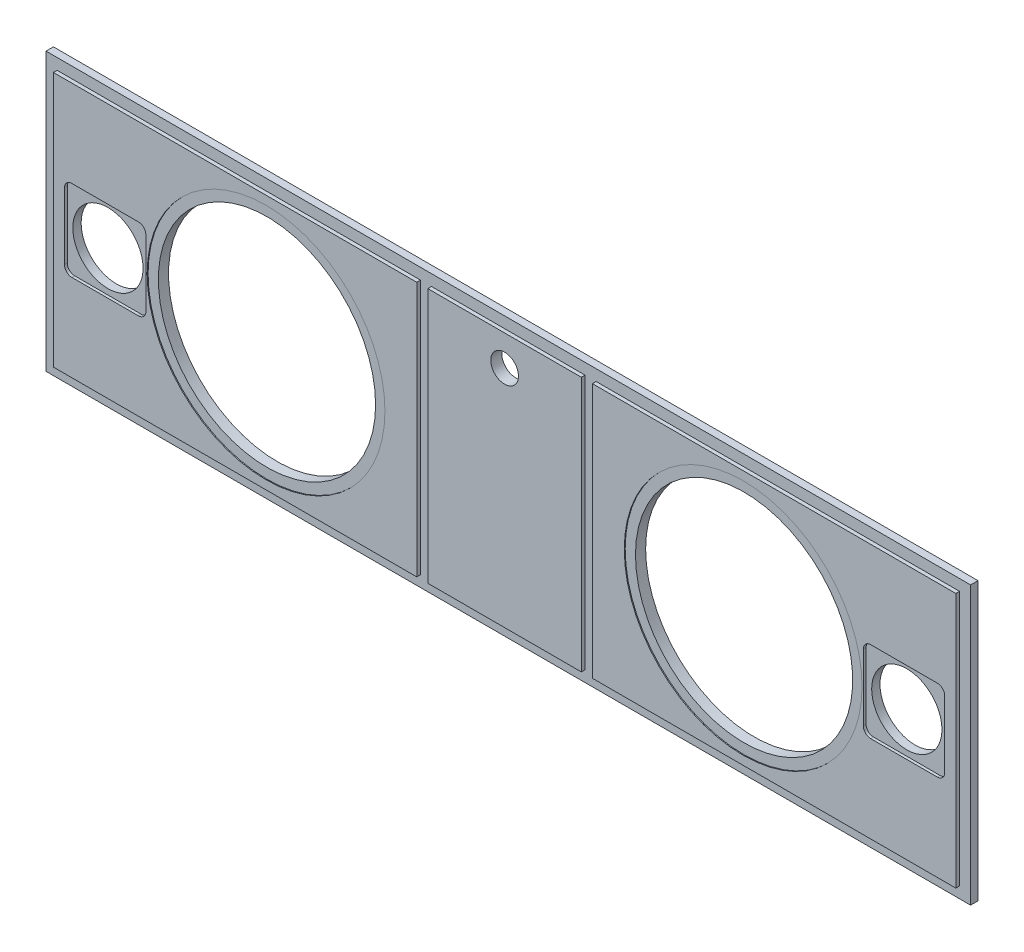
from build123d import *

# Parameters (mm, degrees)
PANEL_W                      = 1000
PANEL_H                      = 300
PANEL_R                      = 117.475
PANEL_R_2                    = 38
PANEL_PLY_DEPTH              = 12
PIZEO_POCKET_CUT_DEPTH       = 3
SKETCH6_R                    = 15
CORD_CUT_DEPTH               = 12
SKETCH7_W                    = 1000
SKETCH7_H                    = 12
HORIZONTAL_HOUSING_CUT_DEPTH = 4
SKETCH8_W                    = 12
SKETCH8_H                    = 276
VERTICAL_HOUSING_CUT_DEPTH   = 4
SKETCH9_R                    = 128.5875
CUT_EXTRUDE1_DEPTH           = 1


with BuildPart() as part:
    # Panel → Panel Ply (new body)
    with BuildSketch(Plane.XY):
        with Locations((500, 150)):
            Rectangle(PANEL_W, PANEL_H)
        with Locations((242, 150)):
            Circle(PANEL_R, mode=Mode.SUBTRACT)
        with Locations((758, 150)):
            Circle(PANEL_R, mode=Mode.SUBTRACT)
        with Locations((68, 150)):
            Circle(PANEL_R_2, mode=Mode.SUBTRACT)
        with Locations(Location((932, 150, 0), (0, 0, 180))):
            Circle(PANEL_R_2, mode=Mode.SUBTRACT)
    extrude(amount=PANEL_PLY_DEPTH)

    # Sketch4 → Pizeo Pocket Cut (cut)
    with BuildSketch(Plane.XY.offset(12)):
        with BuildLine():
            Line((32, 194), (104, 194))
            ThreePointArc((104, 194), (109.656854249, 191.656854249), (112, 186))
            Line((112, 186), (112, 114))
            ThreePointArc((112, 114), (109.656854249, 108.343145751), (104, 106))
            Line((104, 106), (32, 106))
            ThreePointArc((32, 106), (26.343145751, 108.343145751), (24, 114))
            Line((24, 114), (24, 186))
            ThreePointArc((24, 186), (26.343145751, 191.656854249), (32, 194))
        make_face()
        with BuildLine():
            Line((968, 106), (896, 106))
            ThreePointArc((896, 106), (890.343145751, 108.343145751), (888, 114))
            Line((888, 114), (888, 186))
            ThreePointArc((888, 186), (890.343145751, 191.656854249), (896, 194))
            Line((896, 194), (968, 194))
            ThreePointArc((968, 194), (973.656854249, 191.656854249), (976, 186))
            Line((976, 186), (976, 114))
            ThreePointArc((976, 114), (973.656854249, 108.343145751), (968, 106))
        make_face()
    extrude(amount=-PIZEO_POCKET_CUT_DEPTH, mode=Mode.SUBTRACT)

    # Sketch6 → Cord Cut (cut)
    with BuildSketch(Plane.XY.offset(12)):
        with Locations((500, 255)):
            Circle(SKETCH6_R)
    extrude(amount=-CORD_CUT_DEPTH, mode=Mode.SUBTRACT)

    # Sketch7 → Horizontal Housing Cut (cut)
    with BuildSketch(Plane.XY.offset(12)):
        with Locations((500, 294)):
            Rectangle(SKETCH7_W, SKETCH7_H)
        with Locations((500, 6)):
            Rectangle(SKETCH7_W, SKETCH7_H)
    extrude(amount=-HORIZONTAL_HOUSING_CUT_DEPTH, mode=Mode.SUBTRACT)

    # Sketch8 → Vertical Housing Cut (cut)
    with BuildSketch(Plane.XY.offset(12)):
        with Locations((6, 150)):
            Rectangle(SKETCH8_W, SKETCH8_H)
        with Locations((994, 150)):
            Rectangle(SKETCH8_W, SKETCH8_H)
        with Locations((411, 150)):
            Rectangle(SKETCH8_W, SKETCH8_H)
        with Locations((589, 150)):
            Rectangle(SKETCH8_W, SKETCH8_H)
    extrude(amount=-VERTICAL_HOUSING_CUT_DEPTH, mode=Mode.SUBTRACT)

    # Sketch9 → Cut-Extrude1 (cut)
    with BuildSketch(Plane.XY.offset(12)):
        with Locations((242, 150)):
            Circle(SKETCH9_R)
        with Locations(Location((758, 150, 0), (0, 0, 180))):
            Circle(SKETCH9_R)
    extrude(amount=-CUT_EXTRUDE1_DEPTH, mode=Mode.SUBTRACT)


solid = part.part
